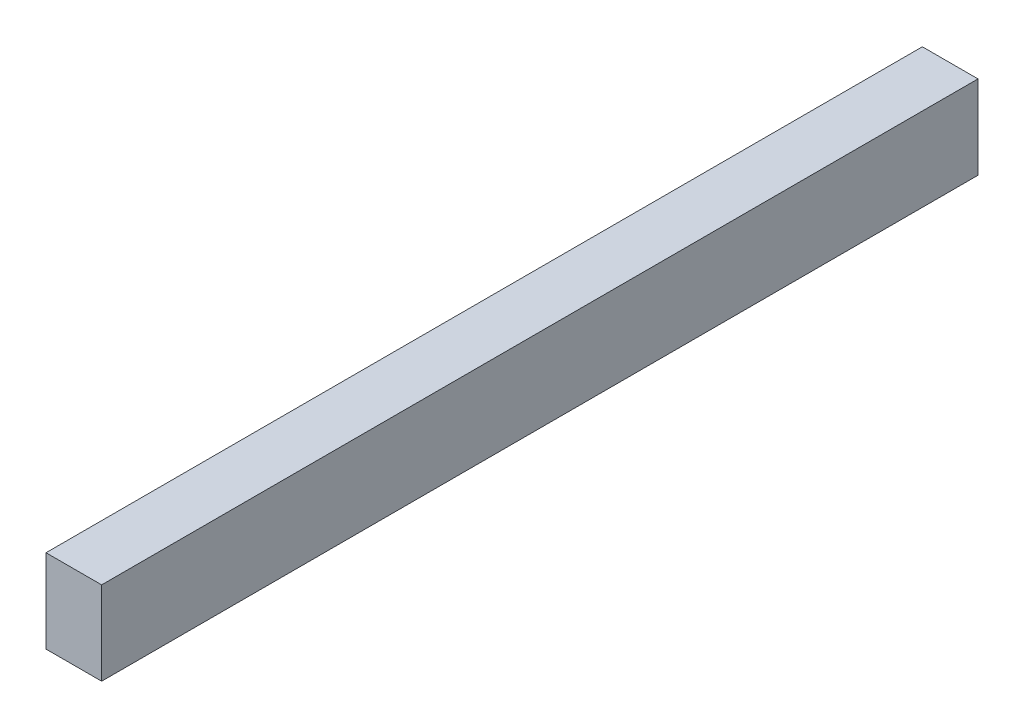
from build123d import *

# Parameters (mm, degrees)
SKETCH1_W           = 63
SKETCH1_H           = 6
BOSS_EXTRUDE1_DEPTH = 4


with BuildPart() as part:
    # Sketch1 → Boss-Extrude1 (new body)
    with BuildSketch(Plane(origin=(0, 0, 0), x_dir=(0, 0, -1), z_dir=(1, 0, 0))):
        Rectangle(SKETCH1_W, SKETCH1_H)
    extrude(amount=BOSS_EXTRUDE1_DEPTH)


solid = part.part
